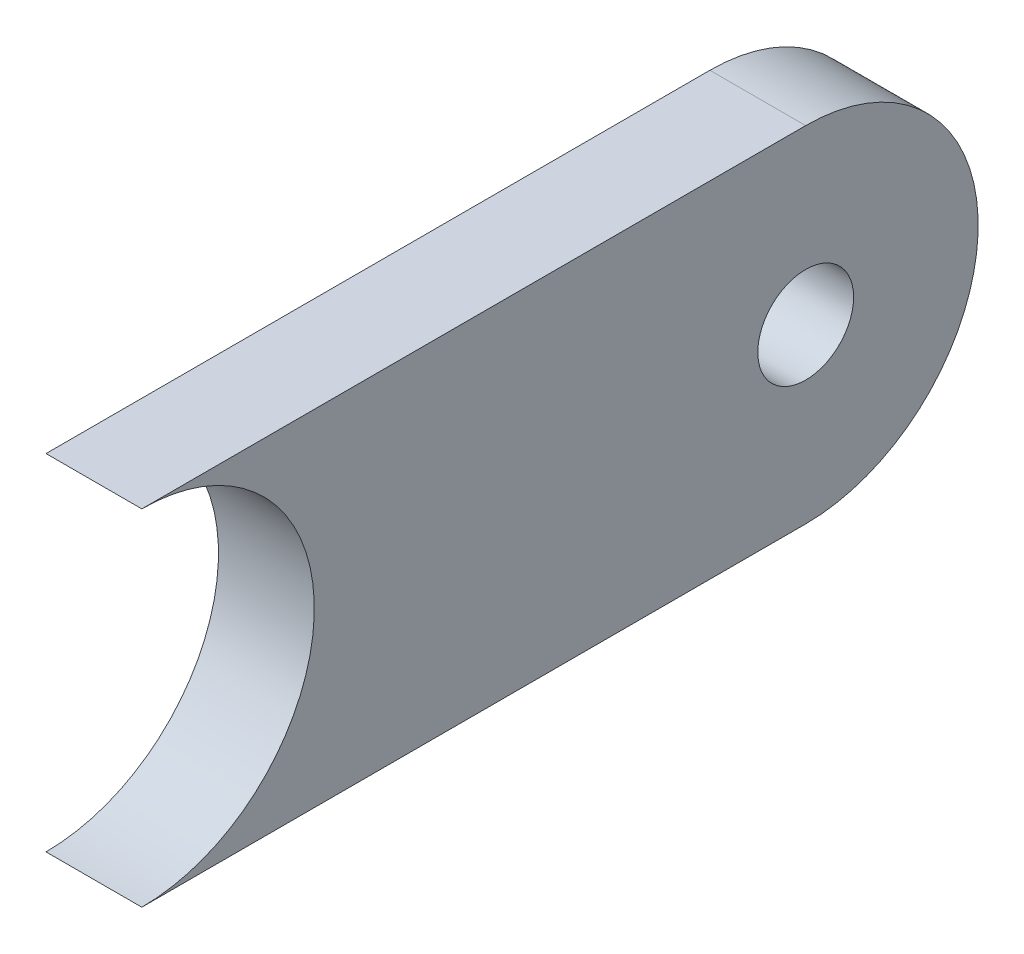
from build123d import *

# Parameters (mm, degrees)
SKETCH_3_R      = 2.5
EXTRUDE_3_DEPTH = 5


with BuildPart() as part:
    # 草圖3 → 填料-伸長3 (new body)
    with BuildSketch(Plane(origin=(0, 0, 0), x_dir=(0, 0, -1), z_dir=(1, 0, 0))):
        with BuildLine():
            Line((0, -9), (-34.64, -9))
            ThreePointArc((-34.64, -9), (-25.64, 0), (-34.64, 9))
            Line((-34.64, 9), (0, 9))
            ThreePointArc((0, 9), (9, 0), (0, -9))
        make_face()
        Circle(SKETCH_3_R, mode=Mode.SUBTRACT)
    extrude(amount=EXTRUDE_3_DEPTH)


solid = part.part
